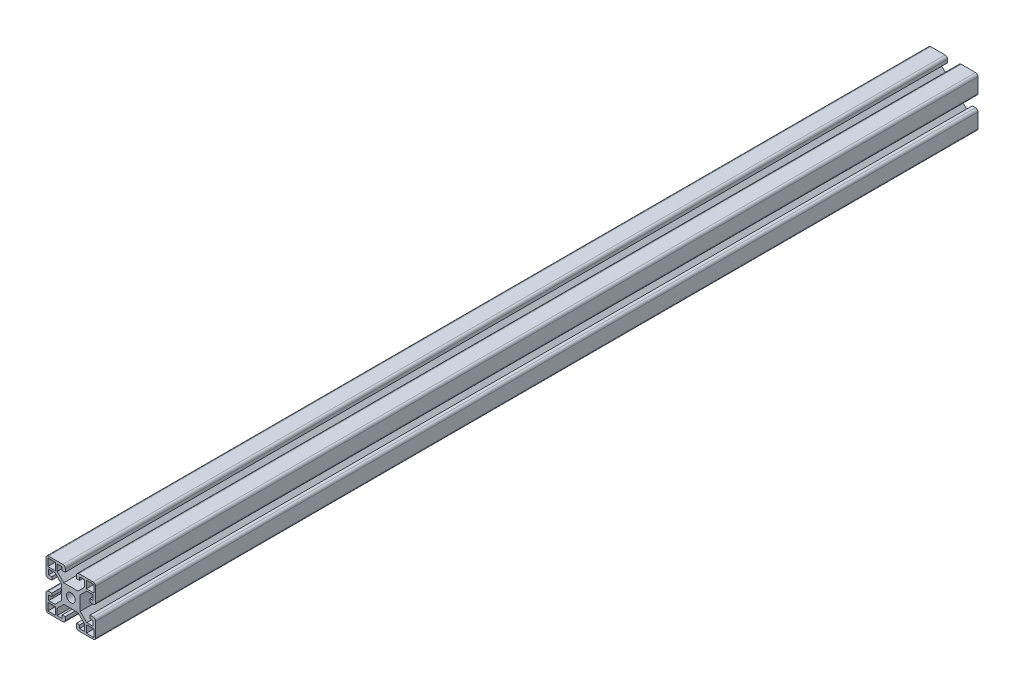
from build123d import *

# Parameters (mm, degrees)
CROQUIS1_W              = 40
CROQUIS1_H              = 40
SALIENTE_EXTRUIR1_DEPTH = 710
CROQUIS2_W              = 6
CROQUIS2_H              = 6
CROQUIS2_R              = 3.5
CORTAR_EXTRUIR2_DEPTH   = 710
REDONDEO1_R             = 2
REDONDEO2_R             = 2


with BuildPart() as part:
    # Croquis1 → Saliente-Extruir1 (new body)
    with BuildSketch(Plane.XY):
        Rectangle(CROQUIS1_W, CROQUIS1_H)
    extrude(amount=SALIENTE_EXTRUIR1_DEPTH)

    # Croquis2 → Cortar-Extruir2 (cut)
    with BuildSketch(Plane.XY.offset(710)):
        with Locations((-15.5, 15.5)):
            Rectangle(CROQUIS2_W, CROQUIS2_H)
        Polygon((4.5, 15.5), (4.5, 20), (-4.5, 20), (-4.5, 15.5), (-7, 15.5), (-7, 18), (-11, 18), (-11, 12.767766953), (-5.733637236, 7.501404189), (5.733637236, 7.501404189), (11, 12.767766953), (11, 18), (7, 18), (7, 15.5), align=None)
        with Locations((15.5, 15.5)):
            Rectangle(CROQUIS2_W, CROQUIS2_H)
        Polygon((15.367588592, -4.5), (20, -4.5), (20, 4.5), (15.367588592, 4.5), (15.367588592, 7), (17.867588592, 7), (17.867588592, 11), (12.767766953, 11), (7.501349817, 5.733582864), (7.501349817, -5.733582864), (12.767766953, -11), (17.867588592, -11), (17.867588592, -7), (15.367588592, -7), align=None)
        Polygon((-20, 4.5), (-20, -4.5), (-15.367588592, -4.5), (-15.367588592, -7), (-17.867588592, -7), (-17.867588592, -11), (-12.767766953, -11), (-7.501349817, -5.733582864), (-7.501349817, 5.733582864), (-12.767766953, 11), (-17.867588592, 11), (-17.867588592, 7), (-15.367588592, 7), (-15.367588592, 4.5), align=None)
        Circle(CROQUIS2_R)
        Polygon((11, -12.767766953), (5.733637236, -7.501404189), (-5.733637236, -7.501404189), (-11, -12.767766953), (-11, -18), (-7, -18), (-7, -15.5), (-4.5, -15.5), (-4.5, -20), (4.5, -20), (4.5, -15.5), (7, -15.5), (7, -18), (11, -18), align=None)
        with Locations((-15.5, -15.5)):
            Rectangle(CROQUIS2_W, CROQUIS2_H)
        with Locations((15.5, -15.5)):
            Rectangle(CROQUIS2_W, CROQUIS2_H)
    extrude(amount=-CORTAR_EXTRUIR2_DEPTH, mode=Mode.SUBTRACT)

    # Redondeo1
    redondeo1_edges = [part.edges().sort_by_distance(p)[0] for p in [
        (20, -20, 355),
        (-20, -20, 355),
        (-20, 20, 355),
        (20, 20, 355),
    ]]
    fillet(redondeo1_edges, radius=REDONDEO1_R)

    # Redondeo2
    redondeo2_edges = [part.edges().sort_by_distance(p)[0] for p in [
        (4.5, 20, 355),
        (-4.5, 20, 355),
        (20, -4.5, 355),
        (20, 4.5, 355),
        (-20, 4.5, 355),
        (-20, -4.5, 355),
        (-4.5, -20, 355),
        (4.5, -20, 355),
    ]]
    fillet(redondeo2_edges, radius=REDONDEO2_R)


solid = part.part
